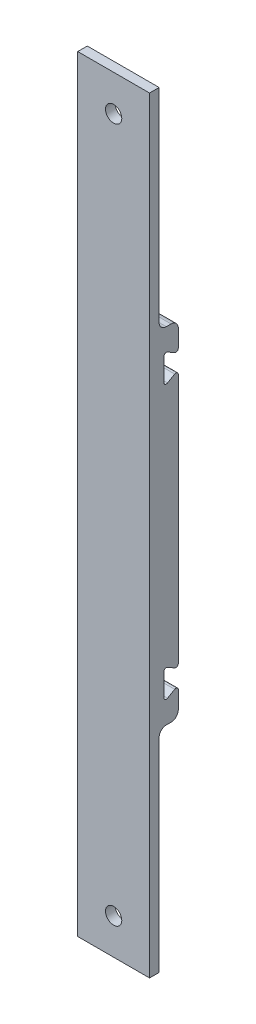
from build123d import *

# Parameters (mm, degrees)
SKETCH_1_W          = 15
SKETCH_1_H          = 160
EXTRUDE_1_DEPTH     = 2
SKETCH_4_W          = 6
SKETCH_4_H          = 15
EXTRUDE_2_DEPTH     = 15
FILLET_3_R          = 1.5
HOLE_WIZARD_M31_D   = 3.4
CUT_EXTRUDE_2_DEPTH = 13.5
FILLET_4_R          = 0.5
SKETCH_8_W          = 6
SKETCH_8_H          = 45
EXTRUDE_3_DEPTH     = 15


with BuildPart() as part:
    # Эскиз1 → Бобышка-Вытянуть1 (new body)
    with BuildSketch(Plane.XY):
        with Locations((7.5, 80)):
            Rectangle(SKETCH_1_W, SKETCH_1_H)
    extrude(amount=-EXTRUDE_1_DEPTH)

    # Эскиз4 → Бобышка-Вытянуть2 (add)
    with BuildSketch(Plane(origin=(15, 0, 0), x_dir=(0, 0, -1), z_dir=(1, 0, 0))):
        with Locations((3, 108.5)):
            Rectangle(SKETCH_4_W, SKETCH_4_H)
        with Locations((3, 51.5)):
            Rectangle(SKETCH_4_W, SKETCH_4_H)
    extrude(amount=-EXTRUDE_2_DEPTH)

    # Скругление3
    fillet_3_edges = [part.edges().sort_by_distance(p)[0] for p in [
        (7.5, 101, -6),
        (7.5, 101, -2),
        (7.5, 116, -6),
        (7.5, 116, -2),
        (7.5, 44, -6),
        (7.5, 44, -2),
        (7.5, 59, -6),
        (7.5, 59, -2),
    ]]
    fillet(fillet_3_edges, radius=FILLET_3_R)

    # Отверстие с зазором M31 (through all)
    with Locations(Plane(origin=(0, 0, -2), x_dir=(-1, 0, 0), z_dir=(0, 0, -1))):
        with Locations((-7.5, 152.5), (-7.5, 7.5)):
            Hole(HOLE_WIZARD_M31_D / 2)

    # Эскиз3 → Вырез-Вытянуть2 (cut)
    with BuildSketch(Plane(origin=(15, 0, 0), x_dir=(0, 0, -1), z_dir=(1, 0, 0))):
        Polygon((6, 110), (3, 111.732050808), (3, 105.267949192), (6, 107), align=None)
        Polygon((6, 53), (3, 54.732050808), (3, 48.267949192), (6, 50), align=None)
    extrude(amount=-CUT_EXTRUDE_2_DEPTH, mode=Mode.SUBTRACT)

    # Скругление4
    fillet_4_edges = [part.edges().sort_by_distance(p)[0] for p in [
        (8.25, 110, -6),
        (8.25, 107, -6),
        (8.25, 105.267949192, -3),
        (8.25, 111.732050808, -3),
        (8.25, 53, -6),
        (8.25, 50, -6),
        (8.25, 48.267949192, -3),
        (8.25, 54.732050808, -3),
    ]]
    fillet(fillet_4_edges, radius=FILLET_4_R)

    # Эскиз8 → Бобышка-Вытянуть3 (add)
    with BuildSketch(Plane(origin=(15, 0, 0), x_dir=(0, 0, -1), z_dir=(1, 0, 0))):
        with Locations((3, 80)):
            Rectangle(SKETCH_8_W, SKETCH_8_H)
    extrude(amount=-EXTRUDE_3_DEPTH)


solid = part.part
